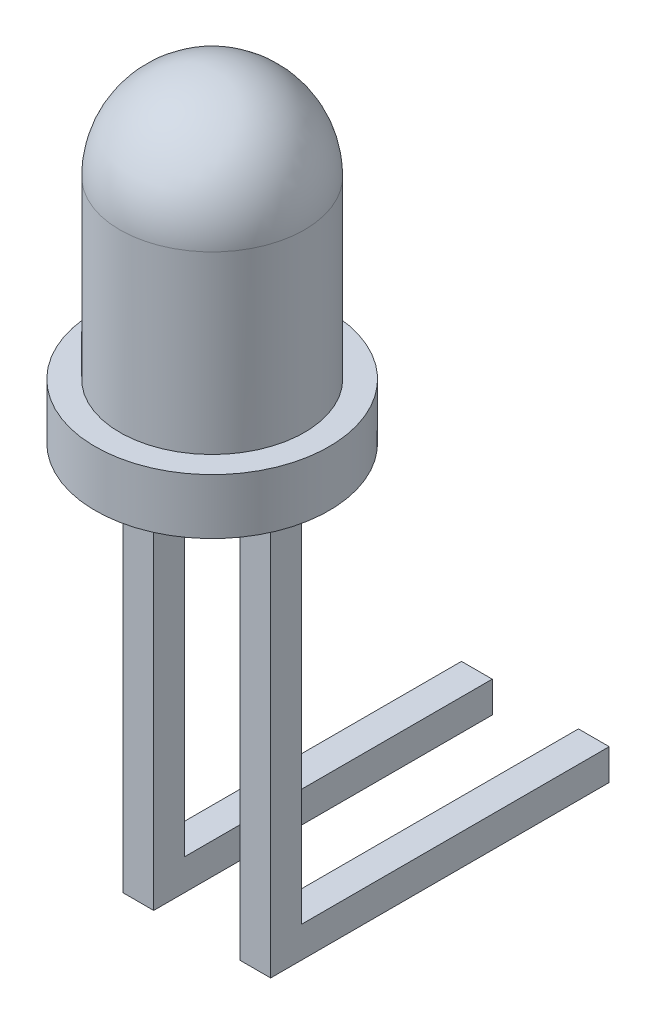
from build123d import *

# Parameters (mm, degrees)
SKICA2_W                = 0.5
SKICA2_H                = 6.8
P_IDAT_VYSUNUT_M1_DEPTH = 0.25
SKICA3_W                = 0.5
SKICA3_H                = 0.504797781
P_IDAT_VYSUNUT_M2_DEPTH = 5


with BuildPart() as part:
    # Skica1 → Rotovat1 (revolve)
    with BuildSketch(Plane.XY):
        with BuildLine():
            Line((-1.5, 6.066522781), (-1.5, 3.216522781))
            Line((-1.5, 3.216522781), (-1.9, 3.216522781))
            Line((-1.9, 3.216522781), (-1.9, 2.316522781))
            Line((-1.9, 2.316522781), (0, 2.316522781))
            Line((0, 2.316522781), (0, 7.566522781))
            ThreePointArc((0, 7.566522781), (-1.060660172, 7.127182953), (-1.5, 6.066522781))
        make_face()
    revolve(axis=Axis((0, 7.566522781, 0), (0, -1, 0)))

    # Skica2 → Přidat vysunutím1 (add, symmetric)
    with BuildSketch(Plane.XY):
        with Locations((0.95, -1.083477219)):
            Rectangle(SKICA2_W, SKICA2_H)
        with Locations((-0.95, -1.083477219)):
            Rectangle(SKICA2_W, SKICA2_H)
    extrude(amount=P_IDAT_VYSUNUT_M1_DEPTH, both=True)

    # Skica3 → Přidat vysunutím2 (add)
    with BuildSketch(Plane(origin=(0, 0, -0.25), x_dir=(-1, 0, 0), z_dir=(0, 0, -1))):
        with Locations((0.95, -4.231078329)):
            Rectangle(SKICA3_W, SKICA3_H)
        with Locations((-0.95, -4.231078329)):
            Rectangle(SKICA3_W, SKICA3_H)
    extrude(amount=P_IDAT_VYSUNUT_M2_DEPTH)


solid = part.part
